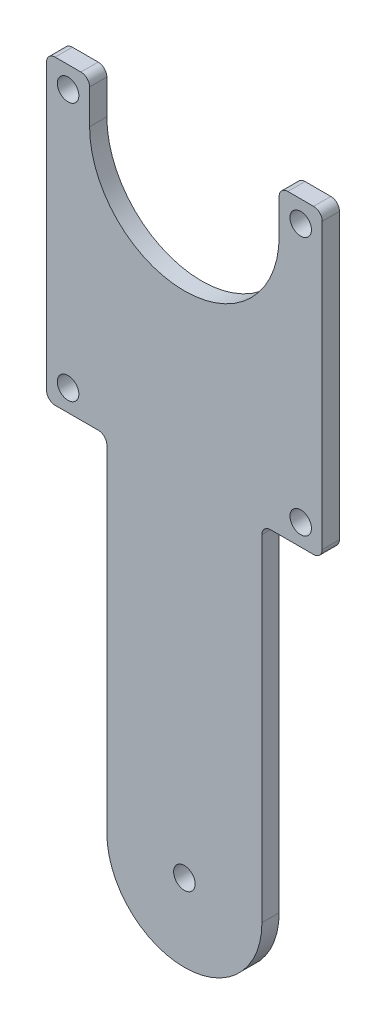
from build123d import *

# Parameters (mm, degrees)
SKETCH_1_R      = 1.25
EXTRUDE_1_DEPTH = 2


with BuildPart() as part:
    # 草圖1 → 填料-伸長1 (new body)
    with BuildSketch(Plane.XY):
        with BuildLine():
            Line((-3.951386067, 19.595813748), (-6.951386067, 19.595813748))
            ThreePointArc((-6.951386067, 19.595813748), (-7.658492848, 19.302920529), (-7.951386067, 18.595813748))
            Line((-7.951386067, 18.595813748), (-7.951386067, -10.404186252))
            Line((-7.951386067, -10.404186252), (-7.951386067, -14.404186252))
            ThreePointArc((-7.951386067, -14.404186252), (-7.658492848, -15.111293033), (-6.951386067, -15.404186252))
            Line((-6.951386067, -15.404186252), (-1.951386067, -15.404186252))
            ThreePointArc((-1.951386067, -15.404186252), (-1.244279286, -15.697079471), (-0.951386067, -16.404186252))
            Line((-0.951386067, -16.404186252), (-0.951386067, -55.404186252))
            ThreePointArc((-0.951386067, -55.404186252), (8.048613933, -64.404186252), (17.048613933, -55.404186252))
            Line((17.048613933, -55.404186252), (17.048613933, -16.404186252))
            ThreePointArc((17.048613933, -16.404186252), (17.341507152, -15.697079471), (18.048613933, -15.404186252))
            Line((18.048613933, -15.404186252), (23.048613933, -15.404186252))
            ThreePointArc((23.048613933, -15.404186252), (23.755720714, -15.111293033), (24.048613933, -14.404186252))
            Line((24.048613933, -14.404186252), (24.048613933, -10.404186252))
            Line((24.048613933, -10.404186252), (24.048613933, 18.595813748))
            ThreePointArc((24.048613933, 18.595813748), (23.755720714, 19.302920529), (23.048613933, 19.595813748))
            Line((23.048613933, 19.595813748), (20.048613933, 19.595813748))
            ThreePointArc((20.048613933, 19.595813748), (19.341507152, 19.302920529), (19.048613933, 18.595813748))
            Line((19.048613933, 18.595813748), (19.048613933, 15.595813748))
            Line((19.048613933, 15.595813748), (19.048613933, 14.595813748))
            ThreePointArc((19.048613933, 14.595813748), (8.048613933, 3.595813748), (-2.951386067, 14.595813748))
            Line((-2.951386067, 14.595813748), (-2.951386067, 15.595813748))
            Line((-2.951386067, 15.595813748), (-2.951386067, 18.595813748))
            ThreePointArc((-2.951386067, 18.595813748), (-3.244279286, 19.302920529), (-3.951386067, 19.595813748))
        make_face()
        with Locations((8.048613933, -55.404186252)):
            Circle(SKETCH_1_R, mode=Mode.SUBTRACT)
        with Locations((-5.451386067, -12.904186252)):
            Circle(SKETCH_1_R, mode=Mode.SUBTRACT)
        with Locations((-5.451386067, 17.095813748)):
            Circle(SKETCH_1_R, mode=Mode.SUBTRACT)
        with Locations((21.548613933, -12.904186252)):
            Circle(SKETCH_1_R, mode=Mode.SUBTRACT)
        with Locations((21.548613933, 17.095813748)):
            Circle(SKETCH_1_R, mode=Mode.SUBTRACT)
    extrude(amount=EXTRUDE_1_DEPTH)


solid = part.part
